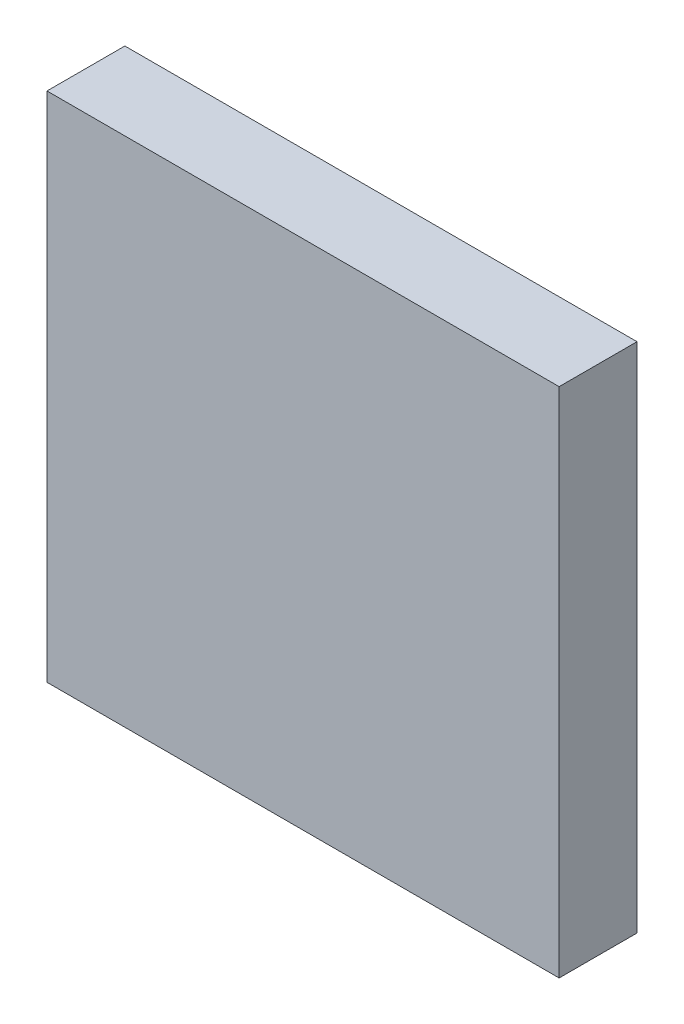
from build123d import *

# Parameters (mm, degrees)
SKETCH1_W           = 14.075
SKETCH1_H           = 14.075
BOSS_EXTRUDE1_DEPTH = 2.14


with BuildPart() as part:
    # Sketch1 → Boss-Extrude1 (new body)
    with BuildSketch(Plane.XY):
        Rectangle(SKETCH1_W, SKETCH1_H)
    extrude(amount=BOSS_EXTRUDE1_DEPTH)


solid = part.part
